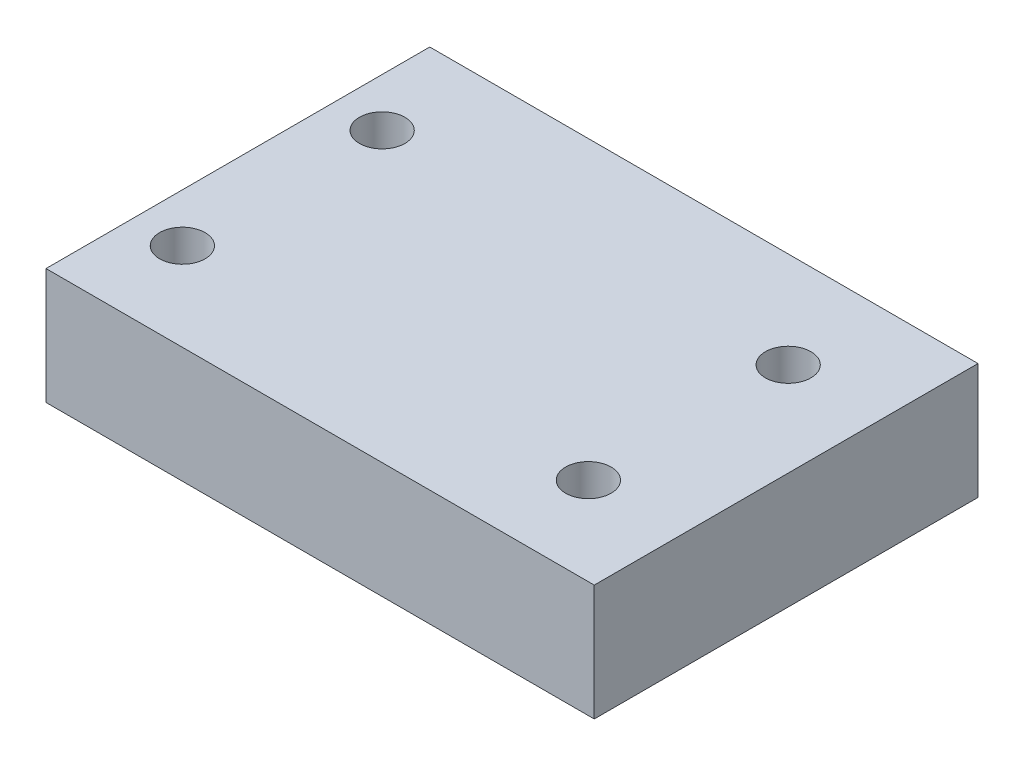
from build123d import *

# Parameters (mm, degrees)
SKETCH1_W              = 60.0202
SKETCH1_H              = 42.0116
BOSS_EXTRUDE1_DEPTH    = 12.7
F_10_CLEARANCE_HOLE1_D = 4.9784


with BuildPart() as part:
    # Sketch1 → Boss-Extrude1 (new body)
    with BuildSketch(Plane(origin=(0, 0, 0), x_dir=(1, 0, 0), z_dir=(0, 1, 0))):
        Rectangle(SKETCH1_W, SKETCH1_H)
    extrude(amount=BOSS_EXTRUDE1_DEPTH)

    # #10 Clearance Hole1 (through all)
    with Locations(Plane(origin=(0, 12.7, 0), x_dir=(1, 0, 0), z_dir=(0, 1, 0))):
        with Locations((-24.7101106, 10.494772), (-24.7101106, -11.3792), (19.7398894, -11.3792), (19.7398894, 10.494772)):
            Hole(F_10_CLEARANCE_HOLE1_D / 2)


solid = part.part
